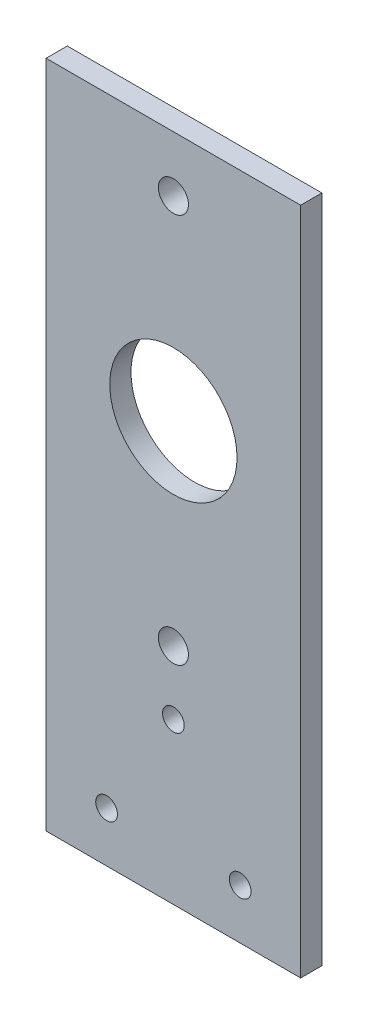
from build123d import *

# Parameters (mm, degrees)
SKETCH1_W           = 76.2
SKETCH1_H           = 200.35
SKETCH1_R           = 19.05
SKETCH1_R_2         = 4.5
SKETCH1_R_3         = 3.25
BOSS_EXTRUDE1_DEPTH = 6.35


with BuildPart() as part:
    # Sketch1 → Boss-Extrude1 (new body)
    with BuildSketch(Plane.XY):
        with Locations((0, -25.175)):
            Rectangle(SKETCH1_W, SKETCH1_H)
        Circle(SKETCH1_R, mode=Mode.SUBTRACT)
        with Locations((0, 58.34)):
            Circle(SKETCH1_R_2, mode=Mode.SUBTRACT)
        with Locations((0, -58.34)):
            Circle(SKETCH1_R_2, mode=Mode.SUBTRACT)
        with Locations((-20, -110.35)):
            Circle(SKETCH1_R_3, mode=Mode.SUBTRACT)
        with Locations((20, -110.35)):
            Circle(SKETCH1_R_3, mode=Mode.SUBTRACT)
        with Locations((0, -77.35)):
            Circle(SKETCH1_R_3, mode=Mode.SUBTRACT)
    extrude(amount=BOSS_EXTRUDE1_DEPTH)


solid = part.part
